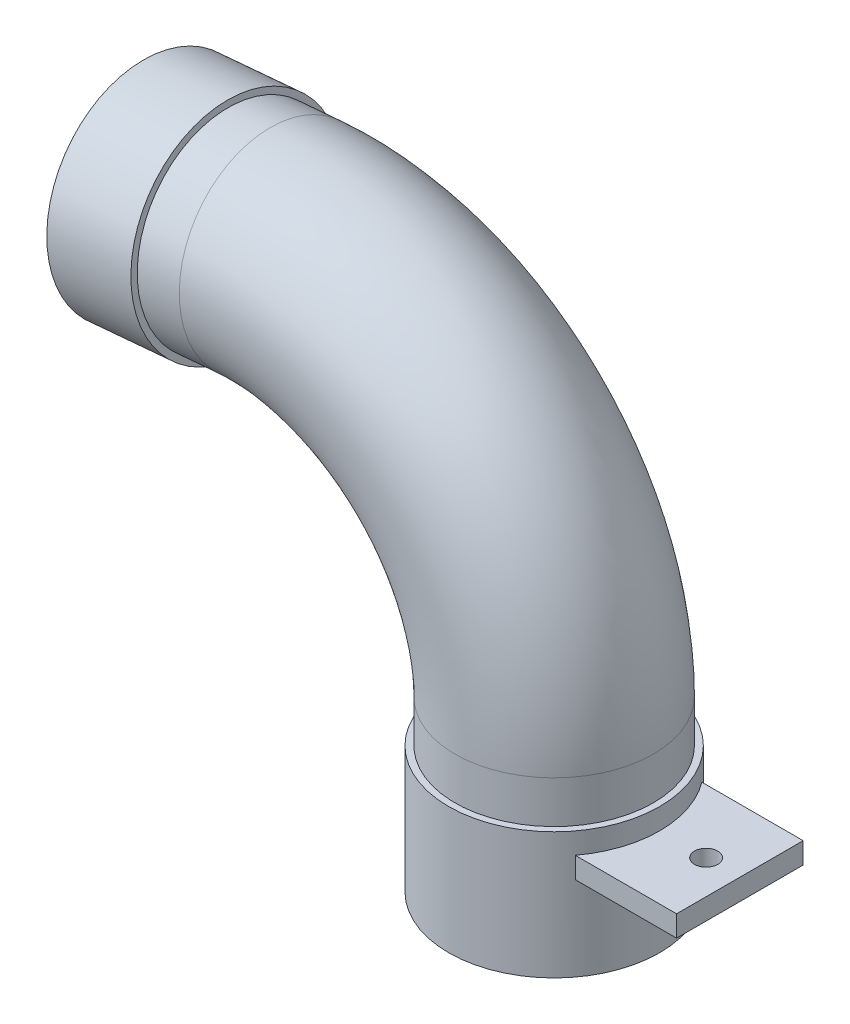
from build123d import *

# Parameters (mm, degrees)
SKETCH_1_R           = 23.5
SKETCH_1_R_2         = 22
EXTRUDE_1_DEPTH      = 20
EXTRUDE_1_DEPTH_BACK = 10
SKETCH_3_R           = 25
SKETCH_3_R_2         = 23
EXTRUDE_2_DEPTH      = 10
EXTRUDE_2_DEPTH_BACK = 10
SKETCH_4_R           = 25
SKETCH_4_R_2         = 23
SKETCH_5_R           = 2.75
EXTRUDE_3_DEPTH      = 5


with BuildPart() as part:
    # 扫描1: sweep along a path in 草图2
    with BuildLine(Plane.XY) as sweep_1_path:
        Line((0, 0), (0, 20))
        ThreePointArc((0, 20), (-19.464587543, 64.236640209), (-65.229344565, 79.771681886))
        Line((-65.229344565, 79.771681886), (-85.153238527, 78.028567031))
    # 草图1 → 扫描1 (sweep)
    with BuildSketch(Plane(origin=(0, 0, 0), x_dir=(1, 0, 0), z_dir=(0, 1, 0))):
        Circle(SKETCH_1_R)
        Circle(SKETCH_1_R_2, mode=Mode.SUBTRACT)
    sweep(path=sweep_1_path.line)

    # 草图4 → 凸台-拉伸2 (add, two sides: drawn at the far end of the back side and taken through both)
    with BuildSketch(Plane(origin=(-77.731644776, -6.800637715, 0), x_dir=(0, 0, 1), z_dir=(-0.9961946980917464, -0.08715574274764801, 0)).offset(-EXTRUDE_2_DEPTH_BACK)):
        with Locations((0, 85.153238527)):
            Circle(SKETCH_4_R)
        with Locations((0, 85.153238527)):
            Circle(SKETCH_4_R_2, mode=Mode.SUBTRACT)
    extrude(amount=EXTRUDE_2_DEPTH + EXTRUDE_2_DEPTH_BACK)


with BuildPart() as body_2:
    # 草图3 → 凸台-拉伸1 (new, two sides: drawn at the far end of the back side and taken through both)
    with BuildSketch(Plane.XZ.offset(-EXTRUDE_1_DEPTH_BACK)):
        Circle(SKETCH_3_R)
        Circle(SKETCH_3_R_2, mode=Mode.SUBTRACT)
    extrude(amount=EXTRUDE_1_DEPTH + EXTRUDE_1_DEPTH_BACK)


    add(part.part)  # 凸台-拉伸3 merges part
    # 草图5 → 凸台-拉伸3 (add)
    with BuildSketch(Plane(origin=(0, 0, 0), x_dir=(-1, 0, 0), z_dir=(0, -1, 0))):
        with BuildLine():
            Line((-44, 15), (-20, 15))
            ThreePointArc((-20, 15), (-25, 0), (-20, -15))
            Line((-20, -15), (-44, -15))
            Line((-44, -15), (-44, 15))
        make_face()
        with Locations((-36, 0)):
            Circle(SKETCH_5_R, mode=Mode.SUBTRACT)
    extrude(amount=-EXTRUDE_3_DEPTH)


solid = body_2.part
